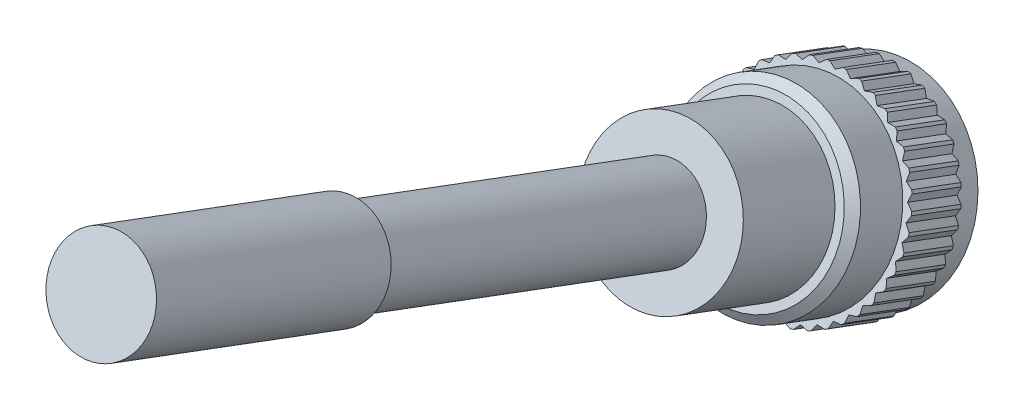
from build123d import *

# Parameters (mm, degrees)
ENL_V_MAT_EXTRU_1_DEPTH  = 3.5
ENL_V_MAT_EXTRU_2_DEPTH  = 3.5
ENL_V_MAT_EXTRU_3_DEPTH  = 3.5
ENL_V_MAT_EXTRU_4_DEPTH  = 3.5
ENL_V_MAT_EXTRU_5_DEPTH  = 3.5
ENL_V_MAT_EXTRU_6_DEPTH  = 3.5
ENL_V_MAT_EXTRU_7_DEPTH  = 3.5
ENL_V_MAT_EXTRU_8_DEPTH  = 3.5
ENL_V_MAT_EXTRU_9_DEPTH  = 3.5
ENL_V_MAT_EXTRU_10_DEPTH = 3.5
ENL_V_MAT_EXTRU_11_DEPTH = 3.5
ENL_V_MAT_EXTRU_12_DEPTH = 3.5
ENL_V_MAT_EXTRU_13_DEPTH = 3.5
ENL_V_MAT_EXTRU_14_DEPTH = 3.5
ENL_V_MAT_EXTRU_15_DEPTH = 3.5
ENL_V_MAT_EXTRU_16_DEPTH = 3.5
ENL_V_MAT_EXTRU_17_DEPTH = 3.5
ENL_V_MAT_EXTRU_18_DEPTH = 3.5
ENL_V_MAT_EXTRU_19_DEPTH = 3.5
ENL_V_MAT_EXTRU_20_DEPTH = 3.5
ENL_V_MAT_EXTRU_21_DEPTH = 3.5
ENL_V_MAT_EXTRU_22_DEPTH = 3.5
ENL_V_MAT_EXTRU_23_DEPTH = 3.5
ENL_V_MAT_EXTRU_24_DEPTH = 3.5
ENL_V_MAT_EXTRU_25_DEPTH = 3.5
ENL_V_MAT_EXTRU_26_DEPTH = 3.5
ENL_V_MAT_EXTRU_27_DEPTH = 3.5
ENL_V_MAT_EXTRU_28_DEPTH = 3.5
ENL_V_MAT_EXTRU_29_DEPTH = 3.5
ENL_V_MAT_EXTRU_30_DEPTH = 3.5
ENL_V_MAT_EXTRU_31_DEPTH = 3.5
ENL_V_MAT_EXTRU_32_DEPTH = 3.5
ENL_V_MAT_EXTRU_33_DEPTH = 3.5
ENL_V_MAT_EXTRU_34_DEPTH = 3.5
ENL_V_MAT_EXTRU_35_DEPTH = 3.5
ENL_V_MAT_EXTRU_36_DEPTH = 3.5
ENL_V_MAT_EXTRU_37_DEPTH = 3.5
ENL_V_MAT_EXTRU_38_DEPTH = 3.5
ENL_V_MAT_EXTRU_39_DEPTH = 3.5
ENL_V_MAT_EXTRU_40_DEPTH = 3.5
CHANFREIN1_SIZE          = 0.5
CHANFREIN2_SIZE          = 0.5


with BuildPart() as part:
    # Esquisse1 → Révolution1 (revolve)
    with BuildSketch(Plane(origin=(0, -2.156174262, 0.896059542), x_dir=(1, 0, 0), z_dir=(0, -0.9234332960375349, 0.3837589709300025)), mode=Mode.PRIVATE) as r_volution1_sk:
        Polygon((-42.984537865, 116.54383808), (-48.972987453, 116.91595572), (-49.190056076, 113.42269346), (-43.201606488, 113.050575821), align=None)
    revolve(r_volution1_sk.sketch.rotate(Axis((-48.949953291, 42.853626789, 109.202449976), (-0.062019606567246074, -0.38302020852975505, -0.921655623461967)), 270), axis=Axis((-48.949953291, 42.853626789, 109.202449976), (-0.062019606567246074, -0.38302020852975505, -0.921655623461967)))

    # Esquisse2 → Enlèv. mat.-Extru.1 (cut)
    with BuildSketch(Plane(origin=(7.048751498, 43.53162521, 104.749478694), x_dir=(0.9980749312557871, -0.02380058039373005, -0.05727096971134314), z_dir=(0.06201960656724606, 0.38302020852975505, 0.9216556234619669))):
        with BuildLine():
            Line((-57.587393059, 3.485303825), (-57.175319592, 3.319192577))
            Line((-57.175319592, 3.319192577), (-56.849895681, 3.621676903))
            ThreePointArc((-56.849895681, 3.621676903), (-57.220777284, 3.565025036), (-57.587393059, 3.485303825))
        make_face()
    extrude(amount=-ENL_V_MAT_EXTRU_1_DEPTH, mode=Mode.SUBTRACT)

    # Esquisse3 → Enlèv. mat.-Extru.2 (cut)
    with BuildSketch(Plane(origin=(7.048751498, 43.53162521, 104.749478694), x_dir=(0.9980749312557871, -0.02380058039373005, -0.05727096971134314), z_dir=(0.06201960656724606, 0.38302020852975505, 0.9216556234619669))):
        with BuildLine():
            Line((-56.658958661, 3.641665732), (-56.277944026, 3.413137096))
            Line((-56.277944026, 3.413137096), (-55.90920765, 3.660989823))
            ThreePointArc((-55.90920765, 3.660989823), (-56.28438539, 3.6630541), (-56.658958661, 3.641665732))
        make_face()
    extrude(amount=-ENL_V_MAT_EXTRU_2_DEPTH, mode=Mode.SUBTRACT)

    # Esquisse4 → Enlèv. mat.-Extru.3 (cut)
    with BuildSketch(Plane(origin=(7.048751498, 43.53162521, 104.749478694), x_dir=(0.9980749312557871, -0.02380058039373005, -0.05727096971134314), z_dir=(0.06201960656724606, 0.38302020852975505, 0.9216556234619669))):
        with BuildLine():
            Line((-55.71749444, 3.650863426), (-55.376920482, 3.365544536))
            Line((-55.376920482, 3.365544536), (-54.973951154, 3.552662707))
            ThreePointArc((-54.973951154, 3.552662707), (-55.344186909, 3.613392298), (-55.71749444, 3.650863426))
        make_face()
    extrude(amount=-ENL_V_MAT_EXTRU_3_DEPTH, mode=Mode.SUBTRACT)

    # Esquisse5 → Enlèv. mat.-Extru.4 (cut)
    with BuildSketch(Plane(origin=(7.048751498, 43.53162521, 104.749478694), x_dir=(0.9980749312557871, -0.02380058039373005, -0.05727096971134314), z_dir=(0.06201960656724606, 0.38302020852975505, 0.9216556234619669))):
        with BuildLine():
            Line((-54.78618237, 3.512670429), (-54.49443515, 3.177586783))
            Line((-54.49443515, 3.177586783), (-54.067155312, 3.299362928))
            ThreePointArc((-54.067155312, 3.299362928), (-54.42333265, 3.417262469), (-54.78618237, 3.512670429))
        make_face()
    extrude(amount=-ENL_V_MAT_EXTRU_4_DEPTH, mode=Mode.SUBTRACT)

    # Esquisse6 → Enlèv. mat.-Extru.5 (cut)
    with BuildSketch(Plane(origin=(7.048751498, 43.53162521, 104.749478694), x_dir=(0.9980749312557871, -0.02380058039373005, -0.05727096971134314), z_dir=(0.06201960656724606, 0.38302020852975505, 0.9216556234619669))):
        with BuildLine():
            Line((-53.887954444, 3.230489512), (-53.652217748, 2.853891981))
            Line((-53.652217748, 2.853891981), (-53.211148447, 2.907327567))
            ThreePointArc((-53.211148447, 2.907327567), (-53.544497099, 3.07949398), (-53.887954444, 3.230489512))
        make_face()
    extrude(amount=-ENL_V_MAT_EXTRU_5_DEPTH, mode=Mode.SUBTRACT)

    # Esquisse7 → Enlèv. mat.-Extru.6 (cut)
    with BuildSketch(Plane(origin=(7.048751498, 43.53162521, 104.749478694), x_dir=(0.9980749312557871, -0.02380058039373005, -0.05727096971134314), z_dir=(0.06201960656724606, 0.38302020852975505, 0.9216556234619669))):
        with BuildLine():
            Line((-53.044928015, 2.811268905), (-52.871006462, 2.402430571))
            Line((-52.871006462, 2.402430571), (-52.427008289, 2.386209835))
            ThreePointArc((-52.427008289, 2.386209835), (-52.729320105, 2.608403813), (-53.044928015, 2.811268905))
        make_face()
    extrude(amount=-ENL_V_MAT_EXTRU_6_DEPTH, mode=Mode.SUBTRACT)

    # Esquisse8 → Enlèv. mat.-Extru.7 (cut)
    with BuildSketch(Plane(origin=(7.048751498, 43.53162521, 104.749478694), x_dir=(0.9980749312557871, -0.02380058039373005, -0.05727096971134314), z_dir=(0.06201960656724606, 0.38302020852975505, 0.9216556234619669))):
        with BuildLine():
            Line((-52.277861192, 2.265331211), (-52.170037308, 1.83431903))
            Line((-52.170037308, 1.83431903), (-51.734042971, 1.748841382))
            ThreePointArc((-51.734042971, 1.748841382), (-51.997874031, 2.01559177), (-52.277861192, 2.265331211))
        make_face()
    extrude(amount=-ENL_V_MAT_EXTRU_7_DEPTH, mode=Mode.SUBTRACT)

    # Esquisse9 → Enlèv. mat.-Extru.8 (cut)
    with BuildSketch(Plane(origin=(7.048751498, 43.53162521, 104.749478694), x_dir=(0.9980749312557871, -0.02380058039373005, -0.05727096971134314), z_dir=(0.06201960656724606, 0.38302020852975505, 0.9216556234619669))):
        with BuildLine():
            Line((-51.605641705, 1.606119227), (-51.566570472, 1.16354615))
            Line((-51.566570472, 1.16354615), (-51.149315599, 1.010916333))
            ThreePointArc((-51.149315599, 1.010916333), (-51.368169507, 1.315654852), (-51.605641705, 1.606119227))
        make_face()
    extrude(amount=-ENL_V_MAT_EXTRU_8_DEPTH, mode=Mode.SUBTRACT)

    # Esquisse10 → Enlèv. mat.-Extru.9 (cut)
    with BuildSketch(Plane(origin=(7.048751498, 43.53162521, 104.749478694), x_dir=(0.9980749312557871, -0.02380058039373005, -0.05727096971134314), z_dir=(0.06201960656724606, 0.38302020852975505, 0.9216556234619669))):
        with BuildLine():
            Line((-51.04482183, 0.849864942), (-51.075465311, 0.406628586))
            Line((-51.075465311, 0.406628586), (-50.687224102, 0.190604853))
            ThreePointArc((-50.687224102, 0.190604853), (-50.855711948, 0.525827829), (-51.04482183, 0.849864942))
        make_face()
    extrude(amount=-ENL_V_MAT_EXTRU_9_DEPTH, mode=Mode.SUBTRACT)

    # Esquisse11 → Enlèv. mat.-Extru.10 (cut)
    with BuildSketch(Plane(origin=(7.048751498, 43.53162521, 104.749478694), x_dir=(0.9980749312557871, -0.02380058039373005, -0.05727096971134314), z_dir=(0.06201960656724606, 0.38302020852975505, 0.9216556234619669))):
        with BuildLine():
            Line((-50.609210812, 0.015189844), (-50.708814463, -0.41779584))
            Line((-50.708814463, -0.41779584), (-50.359146705, -0.691894269))
            ThreePointArc((-50.359146705, -0.691894269), (-50.473119759, -0.334441137), (-50.609210812, 0.015189844))
        make_face()
    extrude(amount=-ENL_V_MAT_EXTRU_10_DEPTH, mode=Mode.SUBTRACT)

    # Esquisse12 → Enlèv. mat.-Extru.11 (cut)
    with BuildSketch(Plane(origin=(7.048751498, 43.53162521, 104.749478694), x_dir=(0.9980749312557871, -0.02380058039373005, -0.05727096971134314), z_dir=(0.06201960656724606, 0.38302020852975505, 0.9216556234619669))):
        with BuildLine():
            Line((-50.309534842, -0.877353595), (-50.47564609, -1.289427062))
            Line((-50.47564609, -1.289427062), (-50.173161764, -1.614850973))
            ThreePointArc((-50.173161764, -1.614850973), (-50.229813631, -1.24396937), (-50.309534842, -0.877353595))
        make_face()
    extrude(amount=-ENL_V_MAT_EXTRU_11_DEPTH, mode=Mode.SUBTRACT)

    # Esquisse13 → Enlèv. mat.-Extru.12 (cut)
    with BuildSketch(Plane(origin=(7.048751498, 43.53162521, 104.749478694), x_dir=(0.9980749312557871, -0.02380058039373005, -0.05727096971134314), z_dir=(0.06201960656724606, 0.38302020852975505, 0.9216556234619669))):
        with BuildLine():
            Line((-50.153172935, -1.805787992), (-50.381701571, -2.186802628))
            Line((-50.381701571, -2.186802628), (-50.133848844, -2.555539004))
            ThreePointArc((-50.133848844, -2.555539004), (-50.131784567, -2.180361264), (-50.153172935, -1.805787992))
        make_face()
    extrude(amount=-ENL_V_MAT_EXTRU_12_DEPTH, mode=Mode.SUBTRACT)

    # Esquisse14 → Enlèv. mat.-Extru.13 (cut)
    with BuildSketch(Plane(origin=(7.048751498, 43.53162521, 104.749478694), x_dir=(0.9980749312557871, -0.02380058039373005, -0.05727096971134314), z_dir=(0.06201960656724606, 0.38302020852975505, 0.9216556234619669))):
        with BuildLine():
            Line((-50.143975241, -2.747252214), (-50.429294131, -3.087826171))
            Line((-50.429294131, -3.087826171), (-50.24217596, -3.4907955))
            ThreePointArc((-50.24217596, -3.4907955), (-50.181446369, -3.120559744), (-50.143975241, -2.747252214))
        make_face()
    extrude(amount=-ENL_V_MAT_EXTRU_13_DEPTH, mode=Mode.SUBTRACT)

    # Esquisse15 → Enlèv. mat.-Extru.14 (cut)
    with BuildSketch(Plane(origin=(7.048751498, 43.53162521, 104.749478694), x_dir=(0.9980749312557871, -0.02380058039373005, -0.05727096971134314), z_dir=(0.06201960656724606, 0.38302020852975505, 0.9216556234619669))):
        with BuildLine():
            Line((-50.282168238, -3.678564284), (-50.617251884, -3.970311503))
            Line((-50.617251884, -3.970311503), (-50.495475739, -4.397591342))
            ThreePointArc((-50.495475739, -4.397591342), (-50.377576198, -4.041414004), (-50.282168238, -3.678564284))
        make_face()
    extrude(amount=-ENL_V_MAT_EXTRU_14_DEPTH, mode=Mode.SUBTRACT)

    # Esquisse16 → Enlèv. mat.-Extru.15 (cut)
    with BuildSketch(Plane(origin=(7.048751498, 43.53162521, 104.749478694), x_dir=(0.9980749312557871, -0.02380058039373005, -0.05727096971134314), z_dir=(0.06201960656724606, 0.38302020852975505, 0.9216556234619669))):
        with BuildLine():
            Line((-50.564349155, -4.57679221), (-50.940946685, -4.812528906))
            Line((-50.940946685, -4.812528906), (-50.8875111, -5.253598207))
            ThreePointArc((-50.8875111, -5.253598207), (-50.715344686, -4.920249555), (-50.564349155, -4.57679221))
        make_face()
    extrude(amount=-ENL_V_MAT_EXTRU_15_DEPTH, mode=Mode.SUBTRACT)

    # Esquisse17 → Enlèv. mat.-Extru.16 (cut)
    with BuildSketch(Plane(origin=(7.048751498, 43.53162521, 104.749478694), x_dir=(0.9980749312557871, -0.02380058039373005, -0.05727096971134314), z_dir=(0.06201960656724606, 0.38302020852975505, 0.9216556234619669))):
        with BuildLine():
            Line((-50.983569762, -5.419818639), (-51.392408096, -5.593740192))
            Line((-51.392408096, -5.593740192), (-51.408628831, -6.037738365))
            ThreePointArc((-51.408628831, -6.037738365), (-51.186434854, -5.735426548), (-50.983569762, -5.419818639))
        make_face()
    extrude(amount=-ENL_V_MAT_EXTRU_16_DEPTH, mode=Mode.SUBTRACT)

    # Esquisse18 → Enlèv. mat.-Extru.17 (cut)
    with BuildSketch(Plane(origin=(7.048751498, 43.53162521, 104.749478694), x_dir=(0.9980749312557871, -0.02380058039373005, -0.05727096971134314), z_dir=(0.06201960656724606, 0.38302020852975505, 0.9216556234619669))):
        with BuildLine():
            Line((-51.529507456, -6.186885462), (-51.960519637, -6.294709346))
            Line((-51.960519637, -6.294709346), (-52.045997285, -6.730703683))
            ThreePointArc((-52.045997285, -6.730703683), (-51.779246896, -6.466872623), (-51.529507456, -6.186885462))
        make_face()
    extrude(amount=-ENL_V_MAT_EXTRU_17_DEPTH, mode=Mode.SUBTRACT)

    # Esquisse19 → Enlèv. mat.-Extru.18 (cut)
    with BuildSketch(Plane(origin=(7.048751498, 43.53162521, 104.749478694), x_dir=(0.9980749312557871, -0.02380058039373005, -0.05727096971134314), z_dir=(0.06201960656724606, 0.38302020852975505, 0.9216556234619669))):
        with BuildLine():
            Line((-52.188719439, -6.859104949), (-52.631292516, -6.898176182))
            Line((-52.631292516, -6.898176182), (-52.783922334, -7.315431055))
            ThreePointArc((-52.783922334, -7.315431055), (-52.479183814, -7.096577147), (-52.188719439, -6.859104949))
        make_face()
    extrude(amount=-ENL_V_MAT_EXTRU_18_DEPTH, mode=Mode.SUBTRACT)

    # Esquisse20 → Enlèv. mat.-Extru.19 (cut)
    with BuildSketch(Plane(origin=(7.048751498, 43.53162521, 104.749478694), x_dir=(0.9980749312557871, -0.02380058039373005, -0.05727096971134314), z_dir=(0.06201960656724606, 0.38302020852975505, 0.9216556234619669))):
        with BuildLine():
            Line((-52.944973725, -7.419924824), (-53.388210081, -7.389281343))
            Line((-53.388210081, -7.389281343), (-53.604233814, -7.777522552))
            ThreePointArc((-53.604233814, -7.777522552), (-53.269010838, -7.609034706), (-52.944973725, -7.419924824))
        make_face()
    extrude(amount=-ENL_V_MAT_EXTRU_19_DEPTH, mode=Mode.SUBTRACT)

    # Esquisse21 → Enlèv. mat.-Extru.20 (cut)
    with BuildSketch(Plane(origin=(7.048751498, 43.53162521, 104.749478694), x_dir=(0.9980749312557871, -0.02380058039373005, -0.05727096971134314), z_dir=(0.06201960656724606, 0.38302020852975505, 0.9216556234619669))):
        with BuildLine():
            Line((-53.779648823, -7.855535842), (-54.212634507, -7.755932191))
            Line((-54.212634507, -7.755932191), (-54.486732935, -8.105599949))
            ThreePointArc((-54.486732935, -8.105599949), (-54.129279804, -7.991626895), (-53.779648823, -7.855535842))
        make_face()
    extrude(amount=-ENL_V_MAT_EXTRU_20_DEPTH, mode=Mode.SUBTRACT)

    # Esquisse22 → Enlèv. mat.-Extru.21 (cut)
    with BuildSketch(Plane(origin=(7.048751498, 43.53162521, 104.749478694), x_dir=(0.9980749312557871, -0.02380058039373005, -0.05727096971134314), z_dir=(0.06201960656724606, 0.38302020852975505, 0.9216556234619669))):
        with BuildLine():
            Line((-54.672192261, -8.155211812), (-55.084265729, -7.989100564))
            Line((-55.084265729, -7.989100564), (-55.40968964, -8.29158489))
            ThreePointArc((-55.40968964, -8.29158489), (-55.038808036, -8.234933023), (-54.672192261, -8.155211812))
        make_face()
    extrude(amount=-ENL_V_MAT_EXTRU_21_DEPTH, mode=Mode.SUBTRACT)

    # Esquisse23 → Enlèv. mat.-Extru.22 (cut)
    with BuildSketch(Plane(origin=(7.048751498, 43.53162521, 104.749478694), x_dir=(0.9980749312557871, -0.02380058039373005, -0.05727096971134314), z_dir=(0.06201960656724606, 0.38302020852975505, 0.9216556234619669))):
        with BuildLine():
            Line((-55.600626659, -8.311573719), (-55.981641294, -8.083045083))
            Line((-55.981641294, -8.083045083), (-56.350377671, -8.33089781))
            ThreePointArc((-56.350377671, -8.33089781), (-55.975199931, -8.332962087), (-55.600626659, -8.311573719))
        make_face()
    extrude(amount=-ENL_V_MAT_EXTRU_22_DEPTH, mode=Mode.SUBTRACT)

    # Esquisse24 → Enlèv. mat.-Extru.23 (cut)
    with BuildSketch(Plane(origin=(7.048751498, 43.53162521, 104.749478694), x_dir=(0.9980749312557871, -0.02380058039373005, -0.05727096971134314), z_dir=(0.06201960656724606, 0.38302020852975505, 0.9216556234619669))):
        with BuildLine():
            Line((-56.54209088, -8.320771413), (-56.882664838, -8.035452523))
            Line((-56.882664838, -8.035452523), (-57.285634167, -8.222570694))
            ThreePointArc((-57.285634167, -8.222570694), (-56.915398411, -8.283300285), (-56.54209088, -8.320771413))
        make_face()
    extrude(amount=-ENL_V_MAT_EXTRU_23_DEPTH, mode=Mode.SUBTRACT)

    # Esquisse25 → Enlèv. mat.-Extru.24 (cut)
    with BuildSketch(Plane(origin=(7.048751498, 43.53162521, 104.749478694), x_dir=(0.9980749312557871, -0.02380058039373005, -0.05727096971134314), z_dir=(0.06201960656724606, 0.38302020852975505, 0.9216556234619669))):
        with BuildLine():
            Line((-57.473402951, -8.182578416), (-57.76515017, -7.84749477))
            Line((-57.76515017, -7.84749477), (-58.192430009, -7.969270915))
            ThreePointArc((-58.192430009, -7.969270915), (-57.836252671, -8.087170456), (-57.473402951, -8.182578416))
        make_face()
    extrude(amount=-ENL_V_MAT_EXTRU_24_DEPTH, mode=Mode.SUBTRACT)

    # Esquisse26 → Enlèv. mat.-Extru.25 (cut)
    with BuildSketch(Plane(origin=(7.048751498, 43.53162521, 104.749478694), x_dir=(0.9980749312557871, -0.02380058039373005, -0.05727096971134314), z_dir=(0.06201960656724606, 0.38302020852975505, 0.9216556234619669))):
        with BuildLine():
            Line((-58.371630877, -7.900397499), (-58.607367573, -7.523799968))
            Line((-58.607367573, -7.523799968), (-59.048436874, -7.577235554))
            ThreePointArc((-59.048436874, -7.577235554), (-58.715088221, -7.749401967), (-58.371630877, -7.900397499))
        make_face()
    extrude(amount=-ENL_V_MAT_EXTRU_25_DEPTH, mode=Mode.SUBTRACT)

    # Esquisse27 → Enlèv. mat.-Extru.26 (cut)
    with BuildSketch(Plane(origin=(7.048751498, 43.53162521, 104.749478694), x_dir=(0.9980749312557871, -0.02380058039373005, -0.05727096971134314), z_dir=(0.06201960656724606, 0.38302020852975505, 0.9216556234619669))):
        with BuildLine():
            Line((-59.214657306, -7.481176892), (-59.388578859, -7.072338558))
            Line((-59.388578859, -7.072338558), (-59.832577032, -7.056117822))
            ThreePointArc((-59.832577032, -7.056117822), (-59.530265215, -7.2783118), (-59.214657306, -7.481176892))
        make_face()
    extrude(amount=-ENL_V_MAT_EXTRU_26_DEPTH, mode=Mode.SUBTRACT)

    # Esquisse28 → Enlèv. mat.-Extru.27 (cut)
    with BuildSketch(Plane(origin=(7.048751498, 43.53162521, 104.749478694), x_dir=(0.9980749312557871, -0.02380058039373005, -0.05727096971134314), z_dir=(0.06201960656724606, 0.38302020852975505, 0.9216556234619669))):
        with BuildLine():
            Line((-59.981724129, -6.935239198), (-60.089548013, -6.504227017))
            Line((-60.089548013, -6.504227017), (-60.52554235, -6.418749369))
            ThreePointArc((-60.52554235, -6.418749369), (-60.261711289, -6.685499757), (-59.981724129, -6.935239198))
        make_face()
    extrude(amount=-ENL_V_MAT_EXTRU_27_DEPTH, mode=Mode.SUBTRACT)

    # Esquisse29 → Enlèv. mat.-Extru.28 (cut)
    with BuildSketch(Plane(origin=(7.048751498, 43.53162521, 104.749478694), x_dir=(0.9980749312557871, -0.02380058039373005, -0.05727096971134314), z_dir=(0.06201960656724606, 0.38302020852975505, 0.9216556234619669))):
        with BuildLine():
            Line((-60.653943616, -6.276027214), (-60.693014849, -5.833454137))
            Line((-60.693014849, -5.833454137), (-61.110269721, -5.68082432))
            ThreePointArc((-61.110269721, -5.68082432), (-60.891415814, -5.985562839), (-60.653943616, -6.276027214))
        make_face()
    extrude(amount=-ENL_V_MAT_EXTRU_28_DEPTH, mode=Mode.SUBTRACT)

    # Esquisse30 → Enlèv. mat.-Extru.29 (cut)
    with BuildSketch(Plane(origin=(7.048751498, 43.53162521, 104.749478694), x_dir=(0.9980749312557871, -0.02380058039373005, -0.05727096971134314), z_dir=(0.06201960656724606, 0.38302020852975505, 0.9216556234619669))):
        with BuildLine():
            Line((-61.214763491, -5.519772929), (-61.18412001, -5.076536573))
            Line((-61.18412001, -5.076536573), (-61.572361219, -4.86051284))
            ThreePointArc((-61.572361219, -4.86051284), (-61.403873373, -5.195735816), (-61.214763491, -5.519772929))
        make_face()
    extrude(amount=-ENL_V_MAT_EXTRU_29_DEPTH, mode=Mode.SUBTRACT)

    # Esquisse31 → Enlèv. mat.-Extru.30 (cut)
    with BuildSketch(Plane(origin=(7.048751498, 43.53162521, 104.749478694), x_dir=(0.9980749312557871, -0.02380058039373005, -0.05727096971134314), z_dir=(0.06201960656724606, 0.38302020852975505, 0.9216556234619669))):
        with BuildLine():
            Line((-61.650374508, -4.685097831), (-61.550770857, -4.252112147))
            Line((-61.550770857, -4.252112147), (-61.900438616, -3.978013718))
            ThreePointArc((-61.900438616, -3.978013718), (-61.786465562, -4.33546685), (-61.650374508, -4.685097831))
        make_face()
    extrude(amount=-ENL_V_MAT_EXTRU_30_DEPTH, mode=Mode.SUBTRACT)

    # Esquisse32 → Enlèv. mat.-Extru.31 (cut)
    with BuildSketch(Plane(origin=(7.048751498, 43.53162521, 104.749478694), x_dir=(0.9980749312557871, -0.02380058039373005, -0.05727096971134314), z_dir=(0.06201960656724606, 0.38302020852975505, 0.9216556234619669))):
        with BuildLine():
            Line((-61.950050479, -3.792554393), (-61.78393923, -3.380480925))
            Line((-61.78393923, -3.380480925), (-62.086423557, -3.055057014))
            ThreePointArc((-62.086423557, -3.055057014), (-62.02977169, -3.425938617), (-61.950050479, -3.792554393))
        make_face()
    extrude(amount=-ENL_V_MAT_EXTRU_31_DEPTH, mode=Mode.SUBTRACT)

    # Esquisse33 → Enlèv. mat.-Extru.32 (cut)
    with BuildSketch(Plane(origin=(7.048751498, 43.53162521, 104.749478694), x_dir=(0.9980749312557871, -0.02380058039373005, -0.05727096971134314), z_dir=(0.06201960656724606, 0.38302020852975505, 0.9216556234619669))):
        with BuildLine():
            Line((-62.106412386, -2.864119995), (-61.87788375, -2.483105359))
            Line((-61.87788375, -2.483105359), (-62.125736477, -2.114368983))
            ThreePointArc((-62.125736477, -2.114368983), (-62.127800754, -2.489546723), (-62.106412386, -2.864119995))
        make_face()
    extrude(amount=-ENL_V_MAT_EXTRU_32_DEPTH, mode=Mode.SUBTRACT)

    # Esquisse34 → Enlèv. mat.-Extru.33 (cut)
    with BuildSketch(Plane(origin=(7.048751498, 43.53162521, 104.749478694), x_dir=(0.9980749312557871, -0.02380058039373005, -0.05727096971134314), z_dir=(0.06201960656724606, 0.38302020852975505, 0.9216556234619669))):
        with BuildLine():
            Line((-62.11561008, -1.922655773), (-61.83029119, -1.582081816))
            Line((-61.83029119, -1.582081816), (-62.017409361, -1.179112487))
            ThreePointArc((-62.017409361, -1.179112487), (-62.078138952, -1.549348243), (-62.11561008, -1.922655773))
        make_face()
    extrude(amount=-ENL_V_MAT_EXTRU_33_DEPTH, mode=Mode.SUBTRACT)

    # Esquisse35 → Enlèv. mat.-Extru.34 (cut)
    with BuildSketch(Plane(origin=(7.048751498, 43.53162521, 104.749478694), x_dir=(0.9980749312557871, -0.02380058039373005, -0.05727096971134314), z_dir=(0.06201960656724606, 0.38302020852975505, 0.9216556234619669))):
        with BuildLine():
            Line((-61.977417083, -0.991343703), (-61.642333437, -0.699596484))
            Line((-61.642333437, -0.699596484), (-61.764109582, -0.272316645))
            ThreePointArc((-61.764109582, -0.272316645), (-61.882009123, -0.628493983), (-61.977417083, -0.991343703))
        make_face()
    extrude(amount=-ENL_V_MAT_EXTRU_34_DEPTH, mode=Mode.SUBTRACT)

    # Esquisse36 → Enlèv. mat.-Extru.35 (cut)
    with BuildSketch(Plane(origin=(7.048751498, 43.53162521, 104.749478694), x_dir=(0.9980749312557871, -0.02380058039373005, -0.05727096971134314), z_dir=(0.06201960656724606, 0.38302020852975505, 0.9216556234619669))):
        with BuildLine():
            Line((-61.695236166, -0.093115777), (-61.318638635, 0.142620919))
            Line((-61.318638635, 0.142620919), (-61.37207422, 0.58369022))
            ThreePointArc((-61.37207422, 0.58369022), (-61.544240634, 0.250341568), (-61.695236166, -0.093115777))
        make_face()
    extrude(amount=-ENL_V_MAT_EXTRU_35_DEPTH, mode=Mode.SUBTRACT)

    # Esquisse37 → Enlèv. mat.-Extru.36 (cut)
    with BuildSketch(Plane(origin=(7.048751498, 43.53162521, 104.749478694), x_dir=(0.9980749312557871, -0.02380058039373005, -0.05727096971134314), z_dir=(0.06201960656724606, 0.38302020852975505, 0.9216556234619669))):
        with BuildLine():
            Line((-61.276015559, 0.749910652), (-60.867177225, 0.923832205))
            Line((-60.867177225, 0.923832205), (-60.850956489, 1.367830378))
            ThreePointArc((-60.850956489, 1.367830378), (-61.073150467, 1.065518561), (-61.276015559, 0.749910652))
        make_face()
    extrude(amount=-ENL_V_MAT_EXTRU_36_DEPTH, mode=Mode.SUBTRACT)

    # Esquisse38 → Enlèv. mat.-Extru.37 (cut)
    with BuildSketch(Plane(origin=(7.048751498, 43.53162521, 104.749478694), x_dir=(0.9980749312557871, -0.02380058039373005, -0.05727096971134314), z_dir=(0.06201960656724606, 0.38302020852975505, 0.9216556234619669))):
        with BuildLine():
            Line((-60.730077865, 1.516977475), (-60.299065684, 1.624801359))
            Line((-60.299065684, 1.624801359), (-60.213588036, 2.060795696))
            ThreePointArc((-60.213588036, 2.060795696), (-60.480338424, 1.796964635), (-60.730077865, 1.516977475))
        make_face()
    extrude(amount=-ENL_V_MAT_EXTRU_37_DEPTH, mode=Mode.SUBTRACT)

    # Esquisse39 → Enlèv. mat.-Extru.38 (cut)
    with BuildSketch(Plane(origin=(7.048751498, 43.53162521, 104.749478694), x_dir=(0.9980749312557871, -0.02380058039373005, -0.05727096971134314), z_dir=(0.06201960656724606, 0.38302020852975505, 0.9216556234619669))):
        with BuildLine():
            Line((-60.070865881, 2.189196962), (-59.628292804, 2.228268195))
            Line((-59.628292804, 2.228268195), (-59.475662987, 2.645523068))
            ThreePointArc((-59.475662987, 2.645523068), (-59.780401506, 2.42666916), (-60.070865881, 2.189196962))
        make_face()
    extrude(amount=-ENL_V_MAT_EXTRU_38_DEPTH, mode=Mode.SUBTRACT)

    # Esquisse40 → Enlèv. mat.-Extru.39 (cut)
    with BuildSketch(Plane(origin=(7.048751498, 43.53162521, 104.749478694), x_dir=(0.9980749312557871, -0.02380058039373005, -0.05727096971134314), z_dir=(0.06201960656724606, 0.38302020852975505, 0.9216556234619669))):
        with BuildLine():
            Line((-59.314611596, 2.750016837), (-58.87137524, 2.719373356))
            Line((-58.87137524, 2.719373356), (-58.655351506, 3.107614565))
            ThreePointArc((-58.655351506, 3.107614565), (-58.990574483, 2.939126719), (-59.314611596, 2.750016837))
        make_face()
    extrude(amount=-ENL_V_MAT_EXTRU_39_DEPTH, mode=Mode.SUBTRACT)

    # Esquisse41 → Enlèv. mat.-Extru.40 (cut)
    with BuildSketch(Plane(origin=(7.048751498, 43.53162521, 104.749478694), x_dir=(0.9980749312557871, -0.02380058039373005, -0.05727096971134314), z_dir=(0.06201960656724606, 0.38302020852975505, 0.9216556234619669))):
        with BuildLine():
            Line((-58.479936498, 3.185627855), (-58.046950814, 3.086024204))
            Line((-58.046950814, 3.086024204), (-57.772852385, 3.435691962))
            ThreePointArc((-57.772852385, 3.435691962), (-58.130305516, 3.321718908), (-58.479936498, 3.185627855))
        make_face()
    extrude(amount=-ENL_V_MAT_EXTRU_40_DEPTH, mode=Mode.SUBTRACT)

    # Esquisse42 → Révolution2 (revolve)
    with BuildSketch(Plane(origin=(0, -2.156174262, 0.896059542), x_dir=(1, 0, 0), z_dir=(0, -0.9234332960375349, 0.3837589709300025)), mode=Mode.PRIVATE) as r_volution2_sk:
        Polygon((-45.895100371, 166.448065122), (-48.972987453, 116.91595572), (-43.483575331, 116.574847884), (-43.266506708, 120.068110143), (-44.264581639, 120.13012975), (-43.861454196, 126.617616803), (-45.857604059, 126.741656016), (-44.431153108, 149.697379435), (-43.932115642, 149.666369631), (-42.900875577, 166.262006302), align=None)
    revolve(r_volution2_sk.sketch.rotate(Axis((-45.794947394, 62.338287905, 156.088089661), (-0.06201960656724418, -0.383020208529754, -0.9216556234619675)), 270), axis=Axis((-45.794947394, 62.338287905, 156.088089661), (-0.06201960656724418, -0.383020208529754, -0.9216556234619675)))

    # Esquisse43 → Révolution3 (revolve)
    with BuildSketch(Plane(origin=(0, -2.156174262, 0.896059542), x_dir=(1, 0, 0), z_dir=(0, -0.9234332960375349, 0.3837589709300025)), mode=Mode.PRIVATE) as r_volution3_sk:
        Polygon((-43.451125221, 113.066080723), (-49.190056076, 113.42269346), (-49.314095289, 111.426543598), (-43.575164434, 111.06993086), align=None)
    revolve(r_volution3_sk.sketch.rotate(Axis((-49.167981671, 41.5071288, 105.962392624), (-0.06201960656724399, -0.38302020852975505, -0.921655623461967)), 270), axis=Axis((-49.167981671, 41.5071288, 105.962392624), (-0.06201960656724399, -0.38302020852975505, -0.921655623461967)))

    # Chanfrein1
    chanfrein1_edges = [part.edges().sort_by_distance(p)[0] for p in [
        (-48.75591883, 38.973060192, 114.196614914),
    ]]
    chamfer(chanfrein1_edges, length=CHANFREIN1_SIZE)

    # Chanfrein2
    chanfrein2_edges = [part.edges().sort_by_distance(p)[0] for p in [
        (-49.314095289, 35.295019991, 105.997654045),
    ]]
    chamfer(chanfrein2_edges, length=CHANFREIN2_SIZE)


solid = part.part
